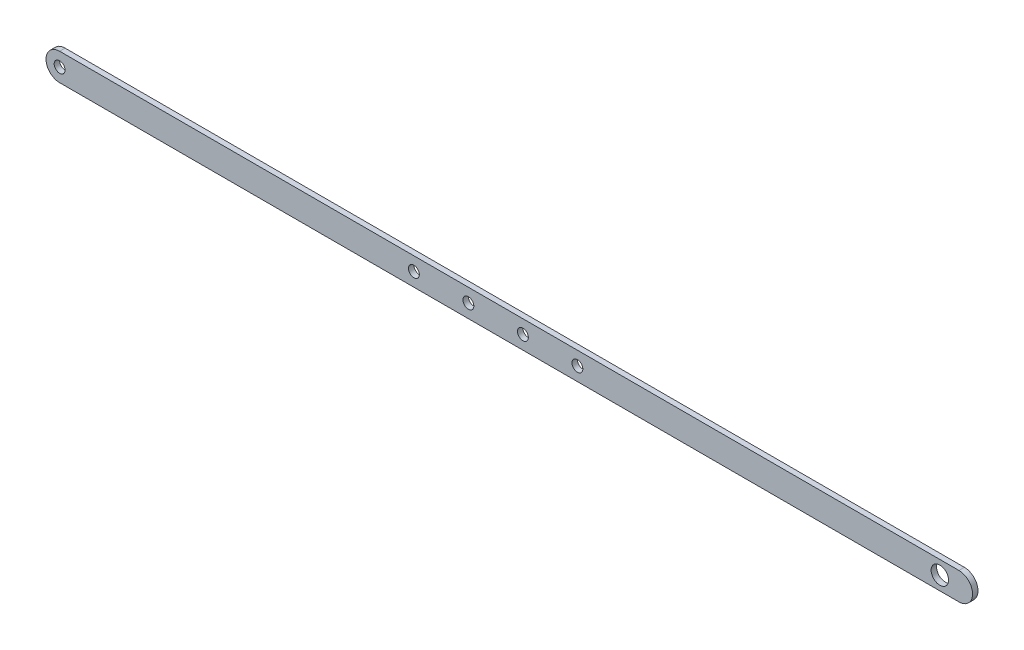
from build123d import *

# Parameters (mm, degrees)
BOSS_EXTRUDE1_DEPTH = 2
SKETCH2_R           = 3.2
CUT_EXTRUDE1_DEPTH  = 2
SKETCH5_R           = 2
CUT_EXTRUDE2_DEPTH  = 2
SKETCH10_R          = 2
CUT_EXTRUDE4_DEPTH  = 2


with BuildPart() as part:
    # Sketch1 → Boss-Extrude1 (new body)
    with BuildSketch(Plane.XY):
        with BuildLine():
            Line((0, 5), (330, 5))
            ThreePointArc((330, 5), (335, 0), (330, -5))
            Line((330, -5), (0, -5))
            ThreePointArc((0, -5), (-5, 0), (0, 5))
        make_face()
    extrude(amount=BOSS_EXTRUDE1_DEPTH)

    # Sketch2 → Cut-Extrude1 (cut)
    with BuildSketch(Plane.XY.offset(2)):
        with Locations((323, 0)):
            Circle(SKETCH2_R)
    extrude(amount=-CUT_EXTRUDE1_DEPTH, mode=Mode.SUBTRACT)

    # Sketch5 → Cut-Extrude2 (cut)
    with BuildSketch(Plane.XY.offset(2)):
        with Locations((190, 0)):
            Circle(SKETCH5_R)
        with Locations((170, 0)):
            Circle(SKETCH5_R)
        with Locations((150, 0)):
            Circle(SKETCH5_R)
        with Locations((130, 0)):
            Circle(SKETCH5_R)
    extrude(amount=-CUT_EXTRUDE2_DEPTH, mode=Mode.SUBTRACT)

    # Sketch10 → Cut-Extrude4 (cut)
    with BuildSketch(Plane.XY.offset(2)):
        Circle(SKETCH10_R)
    extrude(amount=-CUT_EXTRUDE4_DEPTH, mode=Mode.SUBTRACT)


solid = part.part
